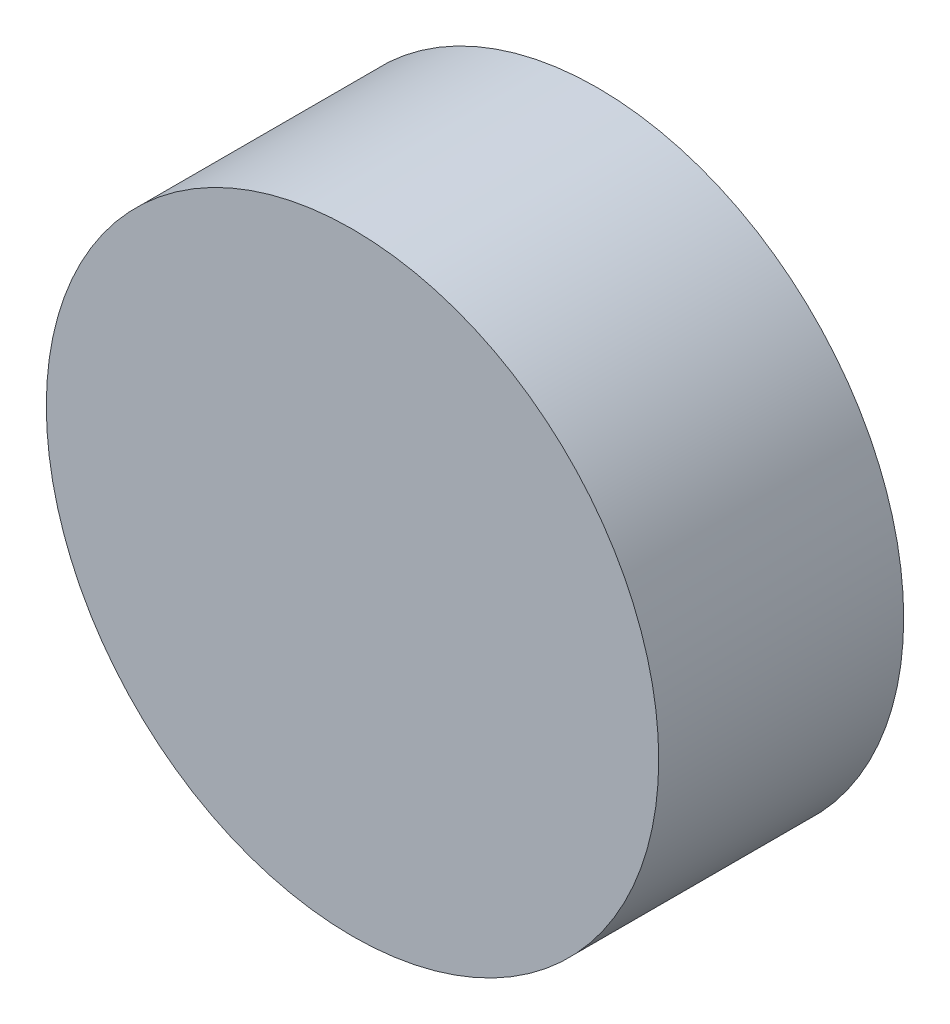
from build123d import *

# Parameters (mm, degrees)
ESQUISSE1_R        = 2.5
BOSS_EXTRU_1_DEPTH = 2


with BuildPart() as part:
    # Esquisse1 → Boss.-Extru.1 (new body)
    with BuildSketch(Plane.XY):
        Circle(ESQUISSE1_R)
    extrude(amount=BOSS_EXTRU_1_DEPTH)


solid = part.part
